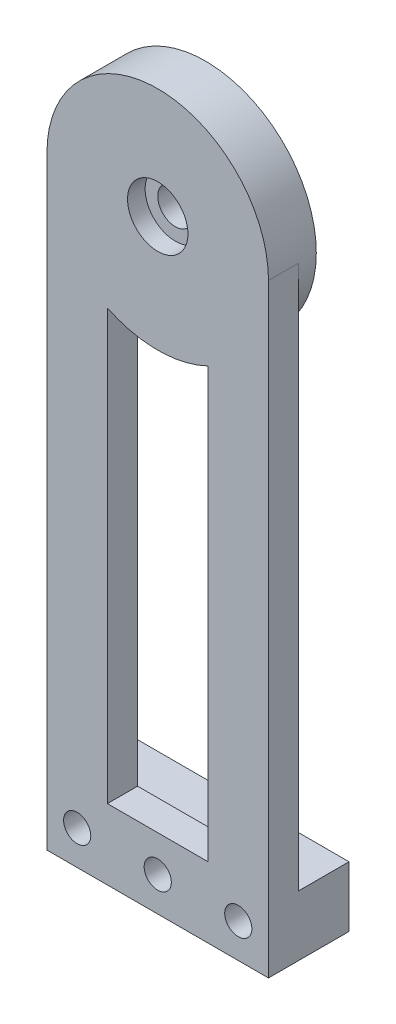
from build123d import *

# Parameters (mm, degrees)
BOSS_EXTRUDE1_DEPTH = 3
BOSS_EXTRUDE2_START = -1.75
BOSS_EXTRUDE2_DEPTH = 1.75
SKETCH2_R           = 1.75
CUT_EXTRUDE1_DEPTH  = 4.75
SKETCH2_3_R         = 3
CUT_EXTRUDE2_DEPTH  = 1.75
SKETCH1_6_W         = 11
SKETCH1_6_H         = 6
BOSS_EXTRUDE3_DEPTH = 5
SKETCH3_R           = 1.35
CUT_EXTRUDE3_DEPTH  = 8
LPATTERN1_COUNT     = 2
LPATTERN1_PITCH     = 8
LPATTERN1_COL_COUNT = 2
LPATTERN1_COL_PITCH = 8


with BuildPart() as part:
    # Sketch1 → Boss-Extrude1 (new body)
    with BuildSketch(Plane.XY):
        with BuildLine():
            Line((-11, 30), (-11, -30))
            Line((-11, -30), (11, -30))
            Line((11, -30), (11, 30))
            ThreePointArc((11, 30), (0, 41), (-11, 30))
        make_face()
        with BuildLine():
            Line((5, -23), (-5, -23))
            Line((-5, -23), (-5, 19.643842411))
            ThreePointArc((-5, 19.643842411), (0, 18.5), (5, 19.643842411))
            Line((5, 19.643842411), (5, -23))
        make_face(mode=Mode.SUBTRACT)
    extrude(amount=BOSS_EXTRUDE1_DEPTH)

    # Sketch1<3> → Boss-Extrude2 (add)
    with BuildSketch(Plane.XY.offset(BOSS_EXTRUDE2_START)):
        with BuildLine():
            ThreePointArc((11, 30), (0, 41), (-11, 30))
            ThreePointArc((-11, 30), (0, 19), (11, 30))
        make_face()
    extrude(amount=BOSS_EXTRUDE2_DEPTH)

    # Sketch2 → Cut-Extrude1 (cut)
    with BuildSketch(Plane.XY.offset(3)):
        with Locations((0, 30)):
            Circle(SKETCH2_R)
    extrude(amount=-CUT_EXTRUDE1_DEPTH, mode=Mode.SUBTRACT)

    # Sketch2<3> → Cut-Extrude2 (cut)
    with BuildSketch(Plane.XY.offset(3)):
        with Locations((0, 30)):
            Circle(SKETCH2_3_R)
    extrude(amount=-CUT_EXTRUDE2_DEPTH, mode=Mode.SUBTRACT)

    # Sketch1<6> → Boss-Extrude3 (add)
    with BuildSketch(Plane.XY):
        with Locations((5.5, -27)):
            Rectangle(SKETCH1_6_W, SKETCH1_6_H)
        with Locations((-5.5, -27)):
            Rectangle(SKETCH1_6_W, SKETCH1_6_H)
    extrude(amount=-BOSS_EXTRUDE3_DEPTH)

    # Sketch3 → Cut-Extrude3 (cut)
    with BuildSketch(Plane.XY.offset(3)):
        with Locations((0, -26.6)):
            Circle(SKETCH3_R)
    cut_extrude3 = extrude(amount=-CUT_EXTRUDE3_DEPTH, mode=Mode.SUBTRACT)

    # LPattern1: Cut-Extrude3 ×2
    with Locations(*[(i * LPATTERN1_PITCH, 0, 0) for i in range(1, LPATTERN1_COUNT)]):
        add(cut_extrude3, mode=Mode.SUBTRACT)

    # LPattern1 col: Cut-Extrude3 ×2
    with Locations(*[(-i * LPATTERN1_COL_PITCH, 0, 0) for i in range(1, LPATTERN1_COL_COUNT)]):
        add(cut_extrude3, mode=Mode.SUBTRACT)


solid = part.part
